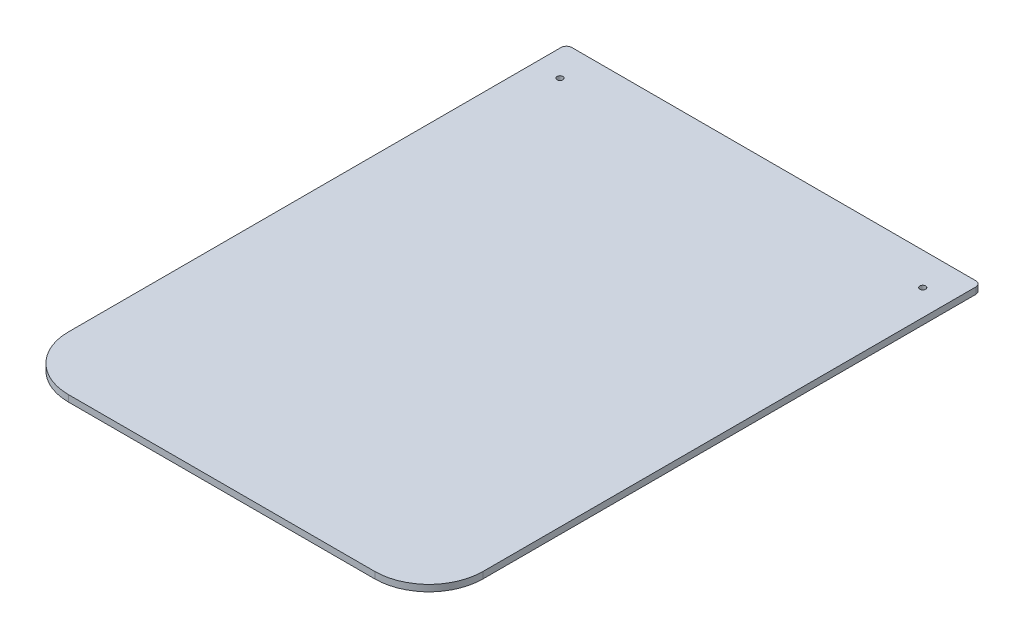
from build123d import *

# Parameters (mm, degrees)
SKETCH1_W           = 383
SKETCH1_H           = 510
BOSS_EXTRUDE1_DEPTH = 6
SKETCH2_R           = 2.7
CUT_EXTRUDE1_DEPTH  = 319.956501737
FILLET1_R           = 50
FILLET2_R           = 5


with BuildPart() as part:
    # Sketch1 → Boss-Extrude1 (new body)
    with BuildSketch(Plane(origin=(0, 0, 0), x_dir=(1, 0, 0), z_dir=(0, 1, 0))):
        Rectangle(SKETCH1_W, SKETCH1_H)
    extrude(amount=BOSS_EXTRUDE1_DEPTH)

    # Sketch2 → Cut-Extrude1 (cut, through all)
    with BuildSketch(Plane.XZ):
        with Locations(Location((-167.5, -225, 0), (0, 0, 270))):
            Circle(SKETCH2_R)
        with Locations(Location((167.5, -225, 0), (0, 0, 270))):
            Circle(SKETCH2_R)
    extrude(amount=-CUT_EXTRUDE1_DEPTH, mode=Mode.SUBTRACT)

    # Fillet1
    fillet1_edges = [part.edges().sort_by_distance(p)[0] for p in [
        (191.5, 3, 255),
        (-191.5, 3, 255),
    ]]
    fillet(fillet1_edges, radius=FILLET1_R)

    # Fillet2
    fillet2_edges = [part.edges().sort_by_distance(p)[0] for p in [
        (-191.5, 3, -255),
        (191.5, 3, -255),
    ]]
    fillet(fillet2_edges, radius=FILLET2_R)


solid = part.part
